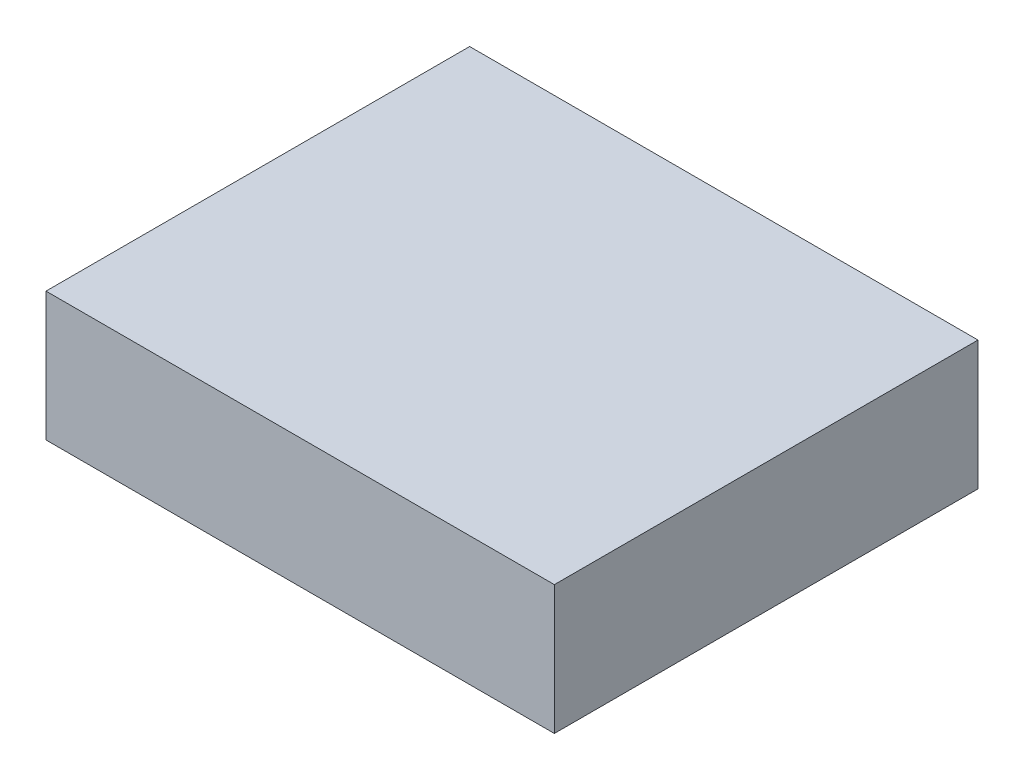
from build123d import *

# Parameters (mm, degrees)
SKETCH1_W           = 55.2
SKETCH1_H           = 46
BOSS_EXTRUDE1_DEPTH = 14


with BuildPart() as part:
    # Sketch1 → Boss-Extrude1 (new body)
    with BuildSketch(Plane(origin=(0, 0, 0), x_dir=(1, 0, 0), z_dir=(0, 1, 0))):
        Rectangle(SKETCH1_W, SKETCH1_H)
    extrude(amount=BOSS_EXTRUDE1_DEPTH)


solid = part.part
